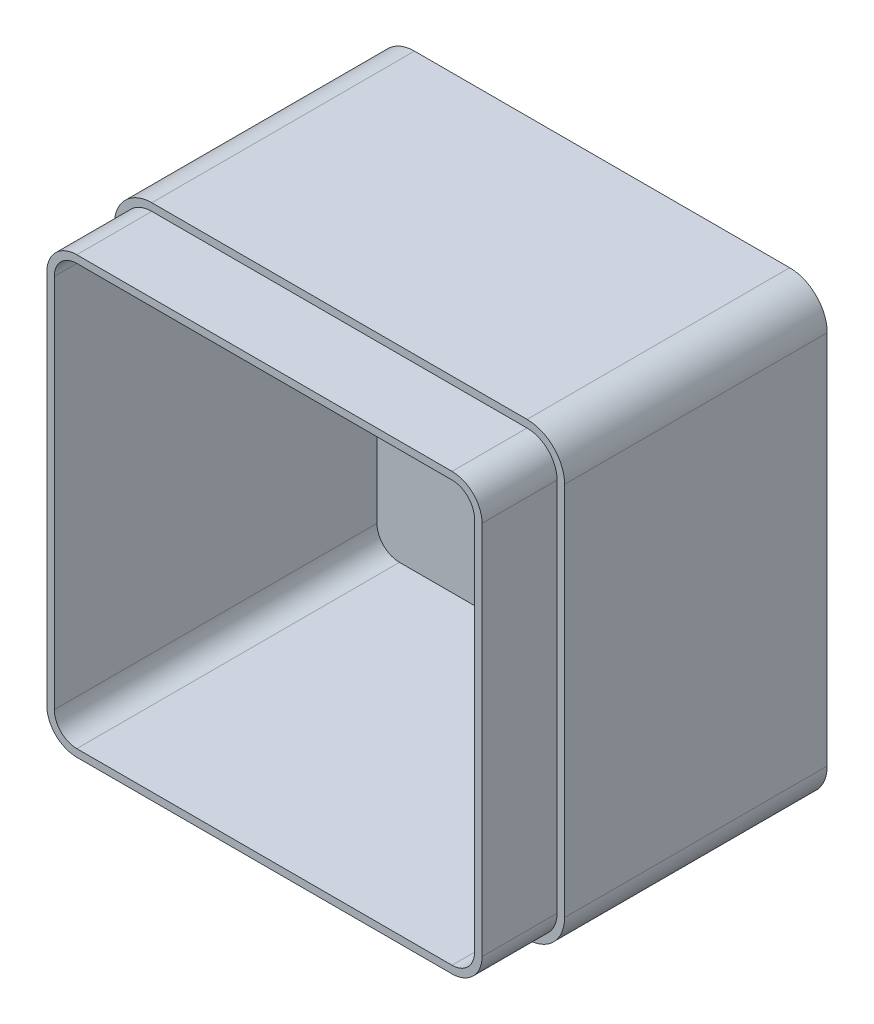
from build123d import *

# Parameters (mm, degrees)
SKETCH_1_W          = 120
SKETCH_1_H          = 120
EXTRUDE_1_DEPTH     = 90
FILLET_1_R          = 10
SHELL_1_T           = -4
CUT_EXTRUDE_1_DEPTH = 20


with BuildPart() as part:
    # Эскиз1 → Бобышка-Вытянуть1 (new body)
    with BuildSketch(Plane.XY):
        with Locations((60, 60)):
            Rectangle(SKETCH_1_W, SKETCH_1_H)
    extrude(amount=EXTRUDE_1_DEPTH)

    # Скругление1
    fillet_1_edges = [part.edges().sort_by_distance(p)[0] for p in [
        (0, 120, 45),
        (120, 120, 45),
        (120, 0, 45),
        (0, 0, 45),
    ]]
    fillet(fillet_1_edges, radius=FILLET_1_R)

    # Оболочка1
    shell_1_openings = [part.faces().sort_by_distance(p)[0] for p in [
        (60, 60, 90),
    ]]
    offset(amount=SHELL_1_T, openings=shell_1_openings, kind=Kind.INTERSECTION)

    # Эскиз2 → Вырез-Вытянуть1 (cut)
    with BuildSketch(Plane.XY.offset(90)):
        with BuildLine():
            Line((0, 110), (0, 10))
            ThreePointArc((0, 10), (2.928932188, 2.928932188), (10, 0))
            Line((10, 0), (110, 0))
            ThreePointArc((110, 0), (117.071067812, 2.928932188), (120, 10))
            Line((120, 10), (120, 110))
            ThreePointArc((120, 110), (117.071067812, 117.071067812), (110, 120))
            Line((110, 120), (10, 120))
            ThreePointArc((10, 120), (2.928932188, 117.071067812), (0, 110))
        make_face()
        with BuildLine():
            Line((2, 110), (2, 10))
            ThreePointArc((2, 10), (4.343145751, 4.343145751), (10, 2))
            Line((10, 2), (110, 2))
            ThreePointArc((110, 2), (115.656854249, 4.343145751), (118, 10))
            Line((118, 10), (118, 110))
            ThreePointArc((118, 110), (115.656854249, 115.656854249), (110, 118))
            Line((110, 118), (10, 118))
            ThreePointArc((10, 118), (4.343145751, 115.656854249), (2, 110))
        make_face(mode=Mode.SUBTRACT)
    extrude(amount=-CUT_EXTRUDE_1_DEPTH, mode=Mode.SUBTRACT)


solid = part.part
